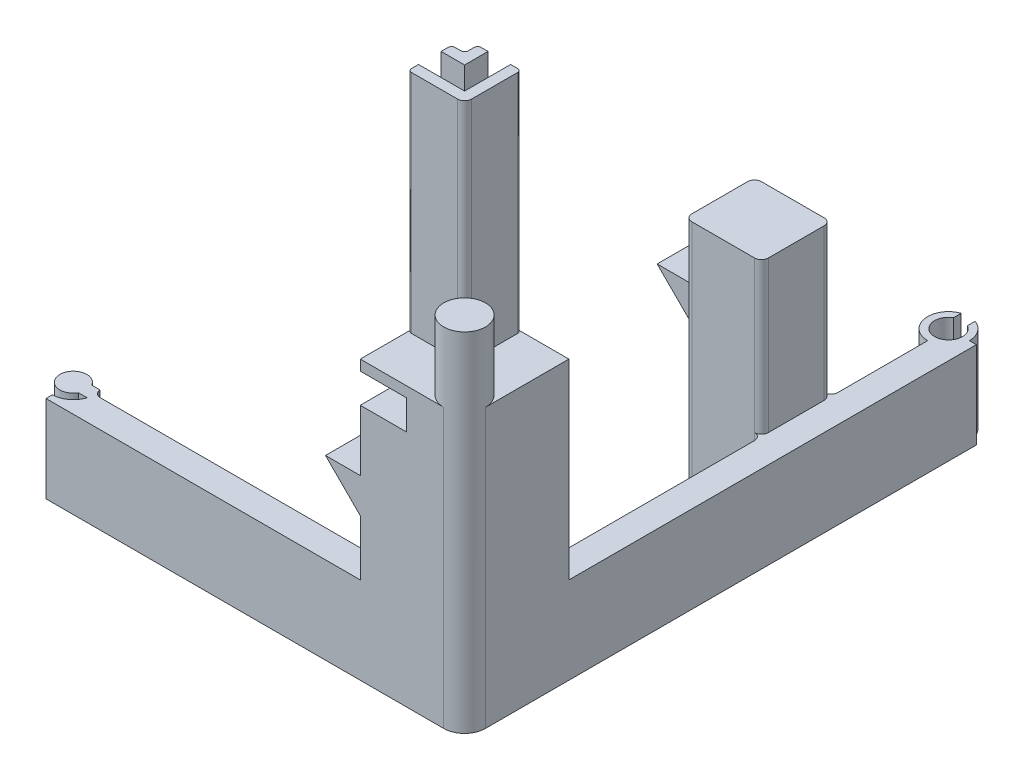
from build123d import *
from build123d.topology import SkipClean

# Parameters (mm, degrees)
SKETCH1_W                 = 30
SKETCH1_H                 = 30
BOSS_EXTRUDE1_DEPTH       = 80
SKETCH2_R                 = 6
BOSS_EXTRUDE2_DEPTH       = 20
CUT_EXTRUDE1_DEPTH        = 83.764726786
BOSS_EXTRUDE3_DEPTH       = 65
BOSS_EXTRUDE5_DEPTH       = 2
BOSS_EXTRUDE6_DEPTH       = 23
BOSS_EXTRUDE7_DEPTH       = 25
FILLET1_R                 = 2
SKETCH11_R                = 6.055782361
CUT_EXTRUDE2_DEPTH        = 2.125
CUT_EXTRUDE4_DEPTH        = 238.593079129
CUT_EXTRUDE4_DEPTH_BACK   = 238.593079129
SKETCH13_W                = 13.25
SKETCH13_H                = 8.5
FILLET2_R                 = 2
CUT_EXTRUDE6_REACH        = 195.534
SKETCH16_W                = 3.75
SKETCH16_H                = 3.75
FILLET4_R                 = 1
BOSS_EXTRUDE8_REACH       = 230.211
SKETCH17_W                = 22
SKETCH17_H                = 20
SKETCH18_W                = 17
SKETCH18_H                = 15
CUT_EXTRUDE7_DEPTH        = 66
FILLET5_R                 = 2
FILLET6_R                 = 2
CHAMFER1_SIZE             = 7
BOSS_EXTRUDE9_DEPTH       = 30
BOSS_EXTRUDE10_DEPTH      = 8
BOSS_EXTRUDE10_DEPTH_BACK = 8


with BuildPart() as part:
    # Sketch1 → Boss-Extrude1 (new body)
    with BuildSketch(Plane(origin=(0, 0, 0), x_dir=(1, 0, 0), z_dir=(0, 1, 0))):
        Rectangle(SKETCH1_W, SKETCH1_H)
    extrude(amount=BOSS_EXTRUDE1_DEPTH)

    # Sketch2 → Boss-Extrude2 (add)
    with BuildSketch(Plane(origin=(0, 80, 0), x_dir=(1, 0, 0), z_dir=(0, 1, 0))):
        with Locations(Location((9, -9, 0), (0, 0, 270))):
            Circle(SKETCH2_R)
    extrude(amount=BOSS_EXTRUDE2_DEPTH)

    # Sketch3 → Cut-Extrude1 (cut, through all)
    with BuildSketch(Plane(origin=(0, 80, 0), x_dir=(1, 0, 0), z_dir=(0, 1, 0))):
        with BuildLine():
            Line((9, -15), (15, -15))
            Line((15, -15), (15, -9))
            ThreePointArc((15, -9), (13.242640687, -13.242640687), (9, -15))
        make_face()
    extrude(amount=-CUT_EXTRUDE1_DEPTH, mode=Mode.SUBTRACT)

    # Sketch4 → Boss-Extrude3 (add)
    with BuildSketch(Plane(origin=(0, 80, 0), x_dir=(1, 0, 0), z_dir=(0, 1, 0))):
        Polygon((-11.25, 1.75), (-1.75, 1.75), (-1.75, 11.25), (-1.75, 15), (1.25, 15), (1.25, 11.25), (1.25, -1.25), (-11.25, -1.25), (-15, -1.25), (-15, 1.75), align=None)
        Polygon((-11.25, 8.25), (-8.25, 8.25), (-8.25, 11.25), (-8.25, 15), (-11.25, 15), (-11.25, 11.25), (-15, 11.25), (-15, 8.25), align=None)
    extrude(amount=BOSS_EXTRUDE3_DEPTH)

    # Sketch6 → Boss-Extrude5 (add)
    with BuildSketch(Plane.XZ):
        with BuildLine():
            Line((15, -15), (7, -15))
            Line((7, -15), (7, -126.175))
            ThreePointArc((7, -126.175), (2.757359313, -136.417640687), (13, -132.175))
            Line((13, -132.175), (15, -132.175))
            Line((15, -132.175), (15, -15))
        make_face()
    extrude(amount=-BOSS_EXTRUDE5_DEPTH)

    # Sketch7 → Boss-Extrude6 (add)
    with SkipClean():  # the faces are left unmerged after this step: merging them gives an invalid solid
        with BuildSketch(Plane(origin=(0, 2, 0), x_dir=(1, 0, 0), z_dir=(0, 1, 0))):
            with BuildLine():
                Line((9, 137.831854249), (9, 135.639101615))
                ThreePointArc((9, 135.639101615), (7, 128.175), (5, 135.639101615))
                Line((5, 135.639101615), (5, 137.831854249))
                ThreePointArc((5, 137.831854249), (1.086408642, 131.160388128), (7, 126.175))
                Line((7, 126.175), (7, 15))
                Line((7, 15), (15, 15))
                Line((15, 15), (15, 132.175))
                Line((15, 132.175), (13, 132.175))
                ThreePointArc((13, 132.175), (11.898979486, 135.639101615), (9, 137.831854249))
            make_face()
        extrude(amount=BOSS_EXTRUDE6_DEPTH)

    # Sketch9 → Boss-Extrude7 (add)
    with SkipClean():  # the faces are left unmerged after this step: merging them gives an invalid solid
        with BuildSketch(Plane.XZ):
            with BuildLine():
                Line((-15, 15), (-15, 7))
                Line((-15, 7), (-99.5, 7))
                ThreePointArc((-99.5, 7), (-99.577697751, 6.037536458), (-99.80877869, 5.1))
                Line((-99.80877869, 5.1), (-102.122778509, 5.1))
                ThreePointArc((-102.122778509, 5.1), (-109.375, 7), (-102.122778509, 8.9))
                Line((-102.122778509, 8.9), (-99.625, 8.9))
                ThreePointArc((-99.625, 8.9), (-101.816885554, 11.955834237), (-105.375001601, 13.173329766))
                Line((-105.375001601, 13.173329766), (-105.375001601, 15))
                Line((-105.375001601, 15), (-15, 15))
            make_face()
        extrude(amount=-BOSS_EXTRUDE7_DEPTH)

    # Fillet1
    fillet1_edges = [part.edges().sort_by_distance(p)[0] for p in [
        (-99.5, 12.5, 7),
    ]]
    fillet(fillet1_edges, radius=FILLET1_R)

    # Sketch11 → Cut-Extrude2 (cut)
    with SkipClean():  # the faces are left unmerged after this step: merging them gives an invalid solid
        with BuildSketch(Plane.XZ):
            with Locations((-105.5, 7)):
                Circle(SKETCH11_R)
        extrude(amount=-CUT_EXTRUDE2_DEPTH, mode=Mode.SUBTRACT)

    # Sketch13 → Cut-Extrude4 (cut, two sides: drawn at the far end of the back side and taken through both)
    with SkipClean():  # the faces are left unmerged after this step: merging them gives an invalid solid
        with BuildSketch(Plane.XY.offset(15).offset(-CUT_EXTRUDE4_DEPTH_BACK)):
            with Locations((-8.375, 72.75)):
                Rectangle(SKETCH13_W, SKETCH13_H)
        extrude(amount=CUT_EXTRUDE4_DEPTH + CUT_EXTRUDE4_DEPTH_BACK, mode=Mode.SUBTRACT)

    # Fillet2
    fillet2_edges = [part.edges().sort_by_distance(p)[0] for p in [
        (1.25, 112.5, 1.25),
    ]]
    fillet(fillet2_edges, radius=FILLET2_R)

    # Sketch16 → Cut-Extrude6 (cut, up to next)
    with BuildSketch(Plane(origin=(0, 80, 0), x_dir=(1, 0, 0), z_dir=(0, 1, 0)), mode=Mode.PRIVATE) as cut_extrude6_sk1:
        with Locations((-13.125, 13.125)):
            Rectangle(SKETCH16_W, SKETCH16_H)
    cut_extrude6_tool1 = extrude(cut_extrude6_sk1.sketch, amount=-CUT_EXTRUDE6_REACH, mode=Mode.PRIVATE) & part.part
    add(cut_extrude6_tool1.solids().sort_by_distance((-13.125, 80, -13.125))[0], mode=Mode.SUBTRACT)

    # Fillet4
    fillet4_edges = [part.edges().sort_by_distance(p)[0] for p in [
        (-11.25, 112.5, -11.25),
        (-15, 112.5, -11.25),
        (-11.25, 112.5, -15),
        (-15, 112.5, 1.25),
        (1.25, 112.5, -15),
    ]]
    fillet(fillet4_edges, radius=FILLET4_R)

    # Boss-Extrude8: up to this face of the body (flat: up to its plane)
    boss_extrude8_end = Plane(part.part.faces().sort_by_distance((-8.375, 68.5, 0))[0])
    # Sketch17 → Boss-Extrude8 (add, up to the picked face)
    with BuildSketch(Plane.XZ, mode=Mode.PRIVATE) as boss_extrude8_sk1:
        with Locations((-4, -88.38125)):
            Rectangle(SKETCH17_W, SKETCH17_H)
    boss_extrude8_tool1 = split(extrude(boss_extrude8_sk1.sketch, amount=-BOSS_EXTRUDE8_REACH, mode=Mode.PRIVATE), bisect_by=boss_extrude8_end, keep=Keep.BOTH, mode=Mode.PRIVATE)
    add(boss_extrude8_tool1.solids().sort_by(Axis((-4, 0, -88.38125), (0, 1, 0)))[0])

    # Sketch18 → Cut-Extrude7 (cut)
    with SkipClean():  # the faces are left unmerged after this step: merging them gives an invalid solid
        with BuildSketch(Plane.XZ):
            with Locations((-4, -88.38125)):
                Rectangle(SKETCH18_W, SKETCH18_H)
        extrude(amount=-CUT_EXTRUDE7_DEPTH, mode=Mode.SUBTRACT)

    # Fillet5
    fillet5_edges = [part.edges().sort_by_distance(p)[0] for p in [
        (7, 13.5, -78.38125),
        (7, 13.5, -98.38125),
        (-15, 34.25, -98.38125),
        (-15, 34.25, -78.38125),
    ]]
    fillet(fillet5_edges, radius=FILLET5_R)

    # Fillet6
    fillet6_edges = [part.edges().sort_by_distance(p)[0] for p in [
        (7, 46.75, -78.38125),
        (7, 46.75, -98.38125),
    ]]
    fillet(fillet6_edges, radius=FILLET6_R)

    # Chamfer1
    chamfer1_edges = [part.edges().sort_by_distance(p)[0] for p in [
        (-12.5, 66, -88.38125),
        (-4, 66, -80.88125),
        (4.5, 66, -88.38125),
        (-4, 66, -95.88125),
    ]]
    chamfer(chamfer1_edges, length=CHAMFER1_SIZE)

    # Sketch19 → Boss-Extrude9 (add)
    with SkipClean():  # the faces are left unmerged after this step: merging them gives an invalid solid
        with BuildSketch(Plane.XY.offset(15)):
            Polygon((-15, 51), (-25, 51), (-15, 41), align=None)
        extrude(amount=-BOSS_EXTRUDE9_DEPTH)

    # Sketch20 → Boss-Extrude10 (add, two sides: drawn at the far end of the back side and taken through both)
    with SkipClean():  # the faces are left unmerged after this step: merging them gives an invalid solid
        with BuildSketch(Plane(origin=(0, 0, -88.38125), x_dir=(-1, 0, 0), z_dir=(0, 0, -1)).offset(-BOSS_EXTRUDE10_DEPTH_BACK)):
            Polygon((25, 51), (15, 51), (15, 41), align=None)
        extrude(amount=BOSS_EXTRUDE10_DEPTH + BOSS_EXTRUDE10_DEPTH_BACK)


solid = part.part
